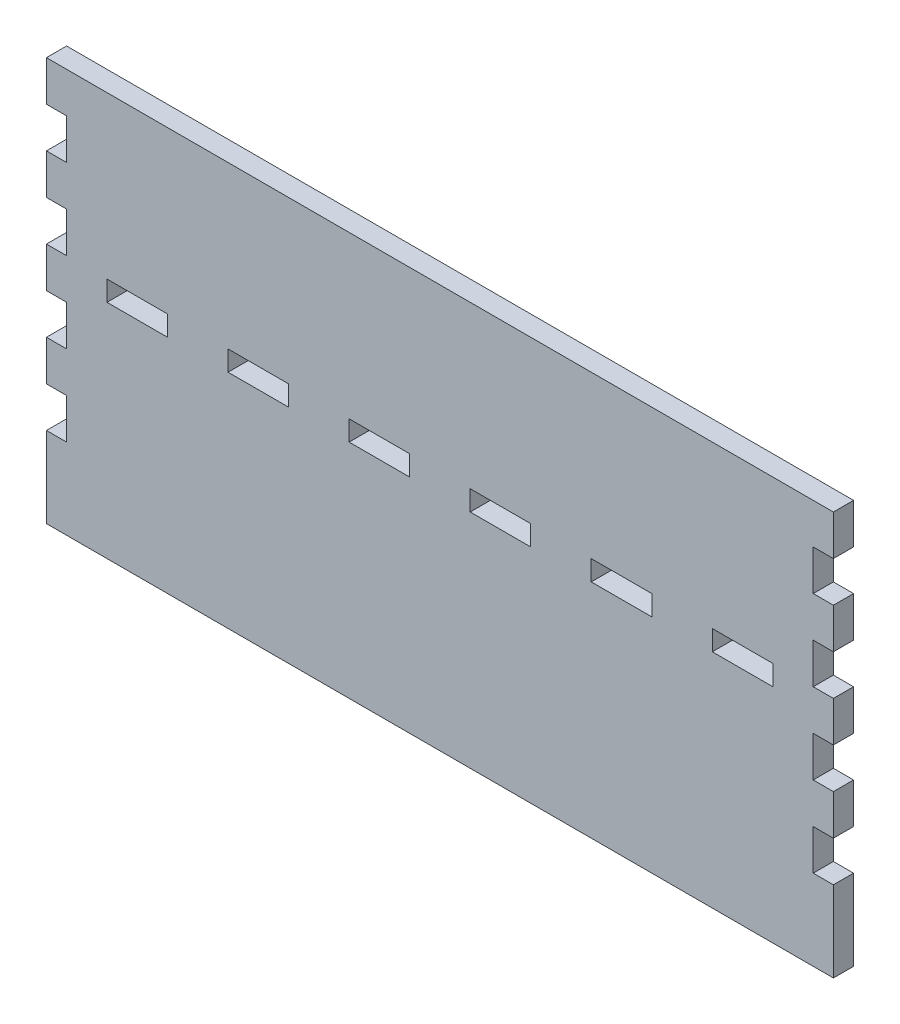
from build123d import *

# Parameters (mm, degrees)
ESQUISSE1_W                     = 247.65
ESQUISSE1_H                     = 127
BOSS_EXTRU_1_DEPTH              = 6.35
ESQUISSE2_W                     = 19.05
ESQUISSE2_H                     = 6.35
ENL_V_MAT_EXTRU_1_DEPTH         = 6.35
R_P_TITION_LIN_AIRE1_COUNT      = 6
R_P_TITION_LIN_AIRE1_PITCH      = 38.1
R_P_TITION_LIN_AIRE1_COUNT_DIR2 = 2
R_P_TITION_LIN_AIRE1_PITCH_DIR2 = 57.15
ESQUISSE3_W                     = 6.35
ESQUISSE3_H                     = 12.7
ENL_V_MAT_EXTRU_2_DEPTH         = 6.35
R_P_TITION_LIN_AIRE2_COUNT      = 4
R_P_TITION_LIN_AIRE2_PITCH      = 25.4
R_P_TITION_LIN_AIRE2_COUNT_DIR2 = 2
R_P_TITION_LIN_AIRE2_PITCH_DIR2 = 241.3


with BuildPart() as part:
    # Esquisse1 → Boss.-Extru.1 (new body)
    with BuildSketch(Plane.XY):
        Rectangle(ESQUISSE1_W, ESQUISSE1_H)
    extrude(amount=BOSS_EXTRU_1_DEPTH)

    # Esquisse2 → Enlèv. mat.-Extru.1 (cut)
    with BuildSketch(Plane.XY.offset(6.35)):
        with Locations((-95.25, 9.525)):
            Rectangle(ESQUISSE2_W, ESQUISSE2_H)
    enl_v_mat_extru_1 = extrude(amount=-ENL_V_MAT_EXTRU_1_DEPTH, mode=Mode.SUBTRACT)

    # Répétition linéaire1: Enl_v. mat.-Extru.1 6 × 2
    with Locations(*[(i * R_P_TITION_LIN_AIRE1_PITCH, j * R_P_TITION_LIN_AIRE1_PITCH_DIR2, 0) for i in range(R_P_TITION_LIN_AIRE1_COUNT) for j in range(R_P_TITION_LIN_AIRE1_COUNT_DIR2) if (i, j) != (0, 0)]):
        add(enl_v_mat_extru_1, mode=Mode.SUBTRACT)

    # Esquisse3 → Enlèv. mat.-Extru.2 (cut)
    with BuildSketch(Plane.XY.offset(6.35)):
        with Locations((-120.65, 44.45)):
            Rectangle(ESQUISSE3_W, ESQUISSE3_H)
    enl_v_mat_extru_2 = extrude(amount=-ENL_V_MAT_EXTRU_2_DEPTH, mode=Mode.SUBTRACT)

    # Répétition linéaire2: Enl_v. mat.-Extru.2 4 × 2
    with Locations(*[(j * R_P_TITION_LIN_AIRE2_PITCH_DIR2, -i * R_P_TITION_LIN_AIRE2_PITCH, 0) for i in range(R_P_TITION_LIN_AIRE2_COUNT) for j in range(R_P_TITION_LIN_AIRE2_COUNT_DIR2) if (i, j) != (0, 0)]):
        add(enl_v_mat_extru_2, mode=Mode.SUBTRACT)


solid = part.part
